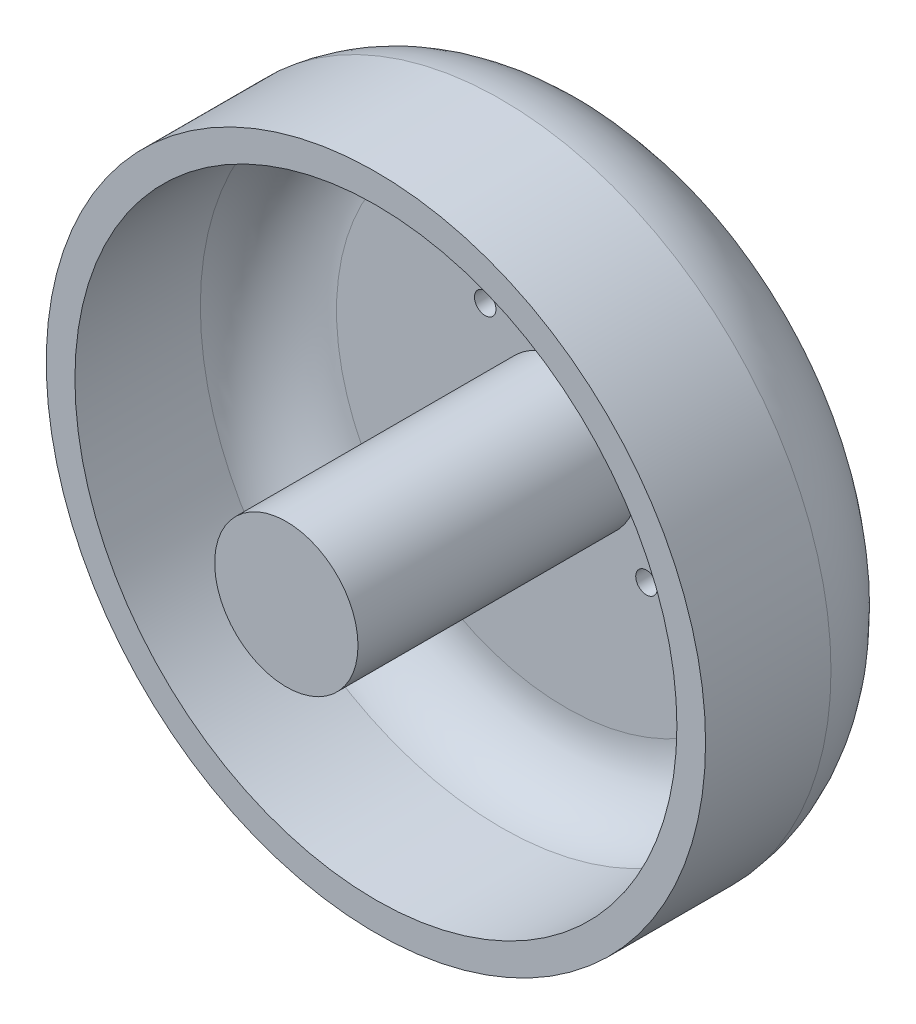
from build123d import *

# Parameters (mm, degrees)
SKETCH3_R            = 1.5
FIXATION_HOLES_DEPTH = 80.101201002
SKETCH4_R            = 1.5
SHAFT_DEPTH          = 6


with BuildPart() as part:
    # Sketch2 → Body (revolve)
    with BuildSketch(Plane(origin=(0, 0, 0), x_dir=(0, 0, -1), z_dir=(1, 0, 0)), mode=Mode.PRIVATE) as body_sk:
        with BuildLine():
            Line((0, 0), (0, 32))
            ThreePointArc((0, 32), (-5.149715015, 41.518162483), (-15, 46))
            Line((-15, 46), (-32.5, 46))
            Line((-32.5, 46), (-32.5, 42))
            Line((-32.5, 42), (-15, 42))
            ThreePointArc((-15, 42), (-8.566932971, 38.739760326), (-6, 32))
            Line((-6, 32), (-6, 10))
            Line((-6, 10), (-45, 10))
            Line((-45, 10), (-45, 0))
            Line((-45, 0), (0, 0))
        make_face()
    revolve(body_sk.sketch.rotate(Axis((0, 0, 677.96312991), (0, 0, -1)), 90), axis=Axis((0, 0, 677.96312991), (0, 0, -1)))

    # Sketch3 → Fixation_Holes (cut, through all)
    with BuildSketch(Plane(origin=(0, 0, 0), x_dir=(-1, 0, 0), z_dir=(0, 0, -1))):
        with Locations((-11.25, 11.25)):
            Circle(SKETCH3_R)
        with Locations((11.25, 11.25)):
            Circle(SKETCH3_R)
        with Locations((11.25, -11.25)):
            Circle(SKETCH3_R)
        with Locations((-11.25, -11.25)):
            Circle(SKETCH3_R)
    extrude(amount=-FIXATION_HOLES_DEPTH, mode=Mode.SUBTRACT)

    # Sketch4 → Shaft (add)
    with BuildSketch(Plane(origin=(0, 0, 0), x_dir=(-1, 0, 0), z_dir=(0, 0, -1))):
        with Locations(Location((0, 0, 0), (0, 0, 180))):
            Circle(SKETCH4_R)
    extrude(amount=SHAFT_DEPTH)


solid = part.part
